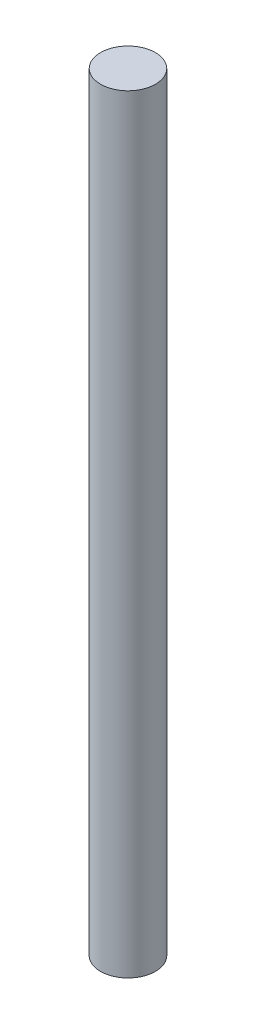
from build123d import *

# Parameters (mm, degrees)
SKETCH1_R           = 1.5875
BOSS_EXTRUDE1_DEPTH = 44.45


with BuildPart() as part:
    # Sketch1 → Boss-Extrude1 (new body)
    with BuildSketch(Plane(origin=(0, 0, 0), x_dir=(1, 0, 0), z_dir=(0, 1, 0))):
        with Locations(Location((0, 0, 0), (0, 0, 270))):
            Circle(SKETCH1_R)
    extrude(amount=BOSS_EXTRUDE1_DEPTH)


solid = part.part
